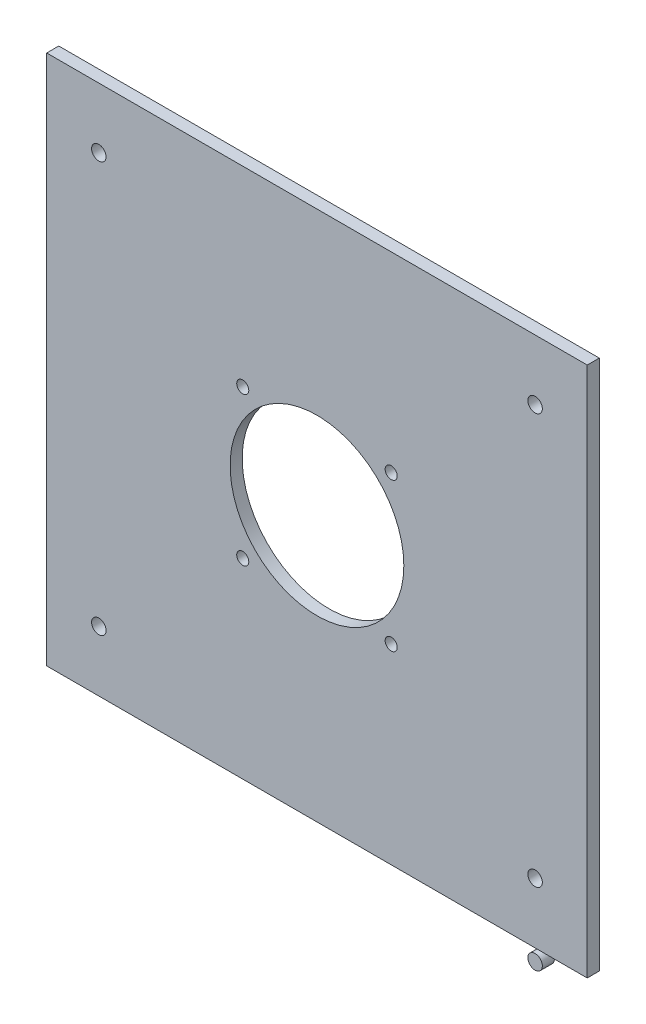
from build123d import *

# Parameters (mm, degrees)
SKETCH_1_R          = 15
EXTRUDE_1_DEPTH     = 25
SKETCH_1_W          = 1120
SKETCH_1_H          = 1100
SKETCH_1_R_2        = 180
SKETCH_1_R_3        = 12.5
EXTRUDE_1_2_DEPTH   = 25
SKETCH_2_R          = 15
CUT_EXTRUDE_1_DEPTH = 814.833521059
SKETCH_4_R          = 15
CUT_EXTRUDE_2_DEPTH = 814.833521059


with BuildPart() as part:
    # 草图1 → 凸台-拉伸1 (new body)
    with BuildSketch(Plane.XY):
        with Locations((452, -575)):
            Circle(SKETCH_1_R)
    extrude(amount=EXTRUDE_1_DEPTH)


with BuildPart() as body_2:
    # 草图1 → Extrude 1 2 (new body)
    with BuildSketch(Plane.XY):
        Rectangle(SKETCH_1_W, SKETCH_1_H)
        with Locations((-452, 425)):
            Circle(SKETCH_1_R, mode=Mode.SUBTRACT)
        Circle(SKETCH_1_R_2, mode=Mode.SUBTRACT)
        with Locations((153.795724908, -153.795724908)):
            Circle(SKETCH_1_R_3, mode=Mode.SUBTRACT)
        with Locations((-153.795724908, -153.795724908)):
            Circle(SKETCH_1_R_3, mode=Mode.SUBTRACT)
        with Locations((-153.795724908, 153.795724908)):
            Circle(SKETCH_1_R_3, mode=Mode.SUBTRACT)
        with Locations((153.795724908, 153.795724908)):
            Circle(SKETCH_1_R_3, mode=Mode.SUBTRACT)
        with Locations((452, 425)):
            Circle(SKETCH_1_R, mode=Mode.SUBTRACT)
    extrude(amount=EXTRUDE_1_2_DEPTH)

    # 草图2 → 切除-拉伸1 (cut, through all)
    with BuildSketch(Plane(origin=(0, 0, 0), x_dir=(-1, 0, 0), z_dir=(0, 0, -1))):
        with Locations((452, -425)):
            Circle(SKETCH_2_R)
    extrude(amount=-CUT_EXTRUDE_1_DEPTH, mode=Mode.SUBTRACT)

    # 草图4 → 切除-拉伸2 (cut, through all)
    with BuildSketch(Plane(origin=(0, 0, 0), x_dir=(-1, 0, 0), z_dir=(0, 0, -1))):
        with Locations((-452, -425)):
            Circle(SKETCH_4_R)
    extrude(amount=-CUT_EXTRUDE_2_DEPTH, mode=Mode.SUBTRACT)


solid = Compound([part.part, body_2.part])
